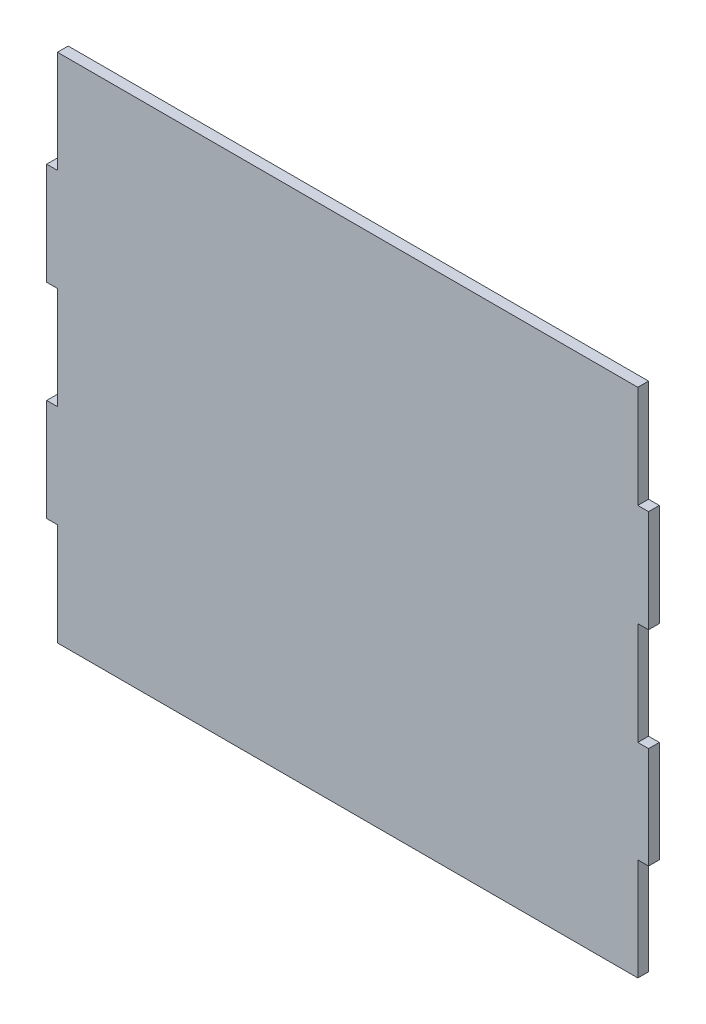
from build123d import *

# Parameters (mm, degrees)
BOSS_EXTRU_1_DEPTH = 5


with BuildPart() as part:
    # Esquisse1 → Boss.-Extru.1 (new body)
    with BuildSketch(Plane.XY):
        Polygon((275, 238), (5, 238), (5, 190.4), (0, 190.4), (0, 142.8), (5, 142.8), (5, 95.2), (0, 95.2), (0, 47.6), (5, 47.6), (5, 0), (275, 0), (275, 47.6), (280, 47.6), (280, 94.918350867), (275, 94.918350867), (275, 142.8), (280, 142.8), (280, 190.4), (275, 190.4), align=None)
    extrude(amount=BOSS_EXTRU_1_DEPTH)


solid = part.part
